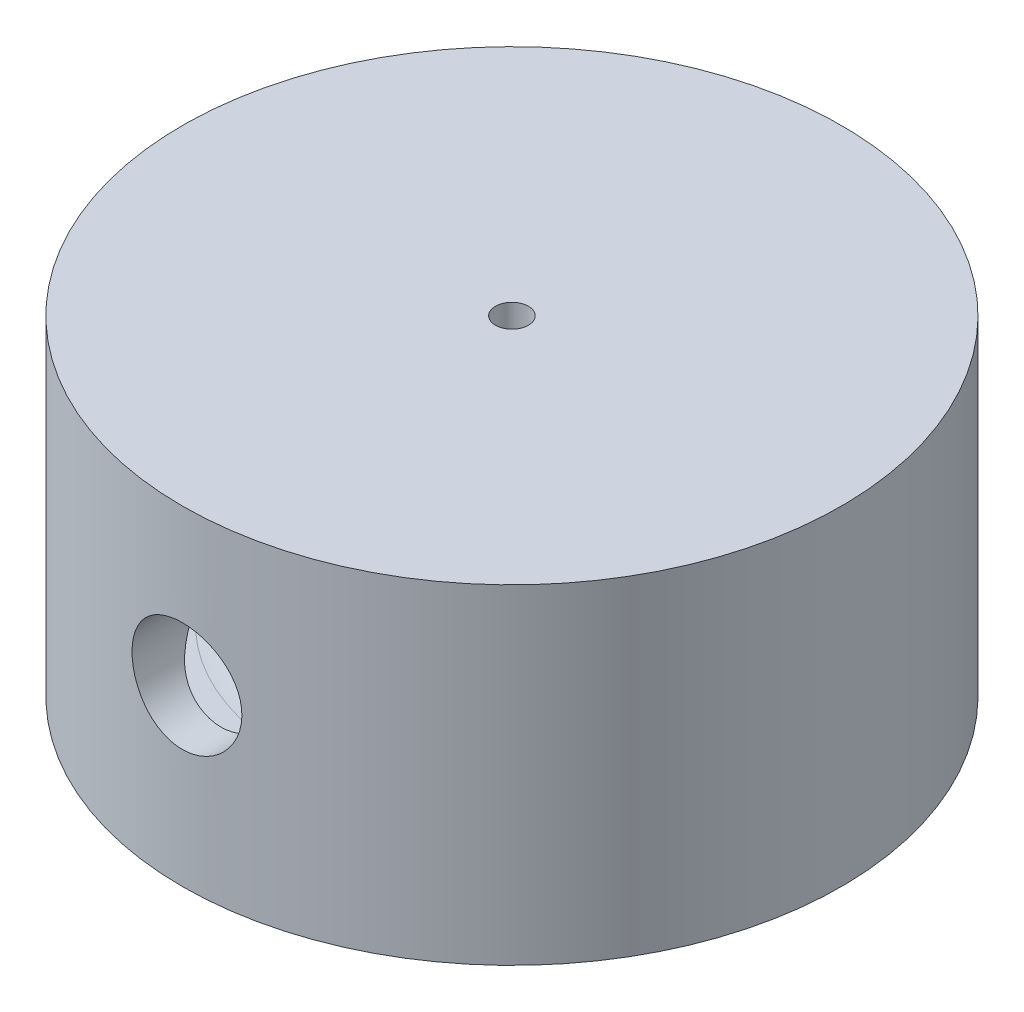
from build123d import *

# Parameters (mm, degrees)
CUT_EXTRUDE2_START = 8
SKETCH3_R          = 2.5
CUT_EXTRUDE2_DEPTH = 19.035850718


with BuildPart() as part:
    # Sketch2 → Revolve1 (revolve)
    with BuildSketch(Plane.XY, mode=Mode.PRIVATE) as revolve1_sk:
        with BuildLine():
            Line((0.75, 15.095215223), (0.75, 0.095215223))
            Line((0.75, 0.095215223), (1.5, 0.095215223))
            Line((1.5, 0.095215223), (1.5, 12.781039466))
            ThreePointArc((1.5, 12.781039466), (2.208615612, 13.603537029), (3.25, 13.910386965))
            Line((3.25, 13.910386965), (4.269554592, 13.910386965))
            ThreePointArc((4.269554592, 13.910386965), (6.437404554, 13.672580701), (8.502148856, 12.970472273))
            Line((8.502148856, 12.970472273), (8.589303094, 12.929756484))
            ThreePointArc((8.589303094, 12.929756484), (8.73707216, 12.862180366), (8.885919712, 12.797014155))
            ThreePointArc((8.885919712, 12.797014155), (10.067814864, 12.018656345), (10.904706183, 10.877459625))
            Line((10.904706183, 10.877459625), (12.847337494, 6.905957348))
            ThreePointArc((12.847337494, 6.905957348), (13.151127383, 6.050403517), (13.254159965, 5.148380822))
            Line((13.254159965, 5.148380822), (13.254159965, 4.920876594))
            ThreePointArc((13.254159965, 4.920876594), (12.668373527, 3.506663032), (11.254159965, 2.920876594))
            Line((11.254159965, 2.920876594), (10.187854447, 2.920876594))
            ThreePointArc((10.187854447, 2.920876594), (6.204992893, 4.835470209), (5.212547535, 9.141733912))
            Line((5.212547535, 9.141733912), (5.236002206, 9.245845457))
            Line((5.236002206, 9.245845457), (5.413981751, 10.035868278))
            ThreePointArc((5.413981751, 10.035868278), (5.308977633, 12.09484591), (3.25, 11.989841792))
            Line((3.25, 11.989841792), (3.25, 0.095215223))
            Line((3.25, 0.095215223), (15, 0.095215223))
            Line((15, 0.095215223), (15, 15.095215223))
            Line((15, 15.095215223), (0.75, 15.095215223))
        make_face()
    revolve(revolve1_sk.sketch.rotate(Axis((0, 28.78036469, 0), (0, -1, 0)), 90), axis=Axis((0, 28.78036469, 0), (0, -1, 0)))

    # Sketch3 → Cut-Extrude2 (cut, through all)
    with BuildSketch(Plane.XY.offset(CUT_EXTRUDE2_START)):
        with Locations(Location((0, 8, 0), (0, 0, 270))):
            Circle(SKETCH3_R)
    extrude(amount=CUT_EXTRUDE2_DEPTH, mode=Mode.SUBTRACT)


solid = part.part
